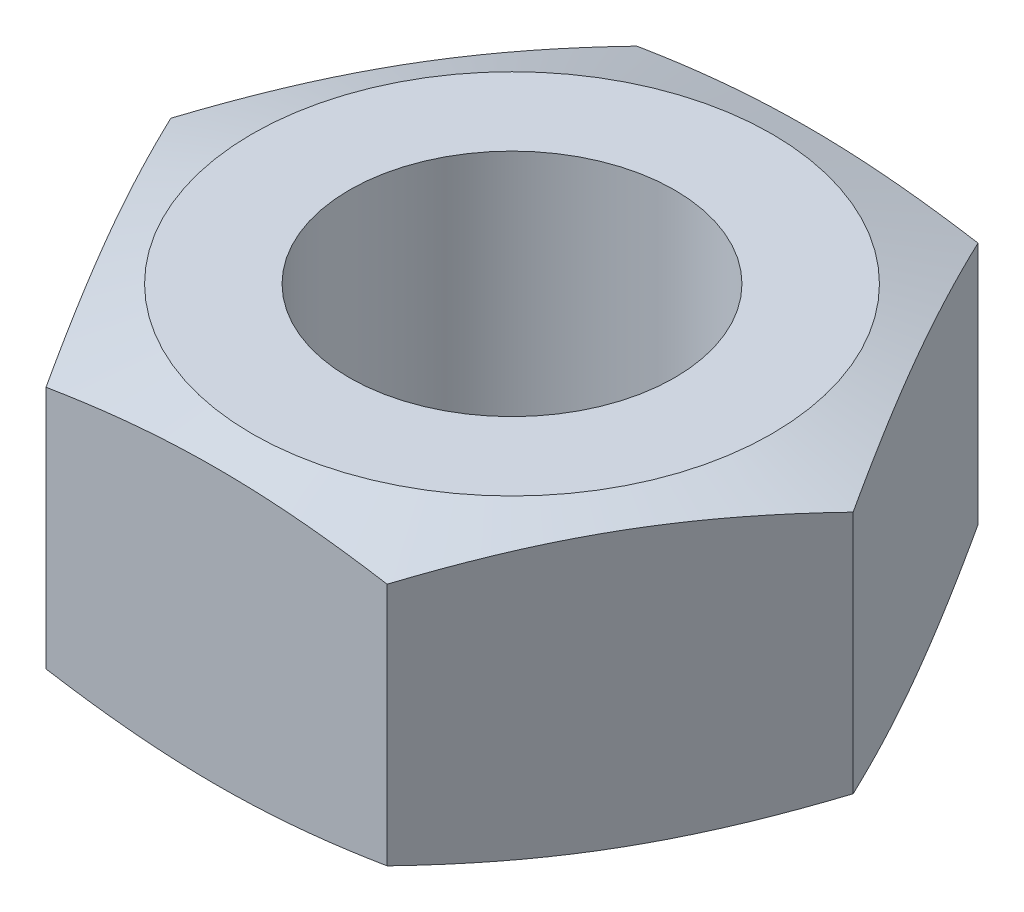
from build123d import *

# Parameters (mm, degrees)
SKETCH_1_R      = 6
EXTRUDE_1_DEPTH = 11


with BuildPart() as part:
    # 草图1 → 凸台-拉伸1 (new body)
    with BuildSketch(Plane(origin=(0, 0, 0), x_dir=(1, 0, 0), z_dir=(0, 1, 0))):
        Polygon((12.586235868, 0), (6.293117934, 10.9), (-6.293117934, 10.9), (-12.586235868, 0), (-6.293117934, -10.9), (6.293117934, -10.9), align=None)
        with Locations(Location((0, 0, 0), (0, 0, 270))):
            Circle(SKETCH_1_R, mode=Mode.SUBTRACT)
    extrude(amount=EXTRUDE_1_DEPTH)

    # 草图2 → 切除-旋转3 (revolve, cut)
    with BuildSketch(Plane.XY):
        Polygon((12.586235868, 10), (9.586235868, 11), (12.586235868, 11), align=None)
        Polygon((12.586235868, 1), (9.586235868, 0), (12.586235868, 0), align=None)
    revolve(axis=Axis((0, 0, 0), (0, 1, 0)), mode=Mode.SUBTRACT)


solid = part.part
